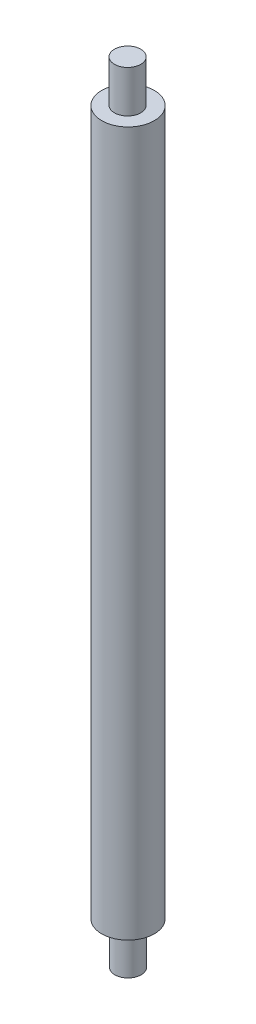
from build123d import *

# Parameters (mm, degrees)
SKETCH1_R           = 6.35
BOSS_EXTRUDE1_DEPTH = 190.5
CUT_EXTRUDE1_START  = -10.16
SKETCH2_R           = 6.35
SKETCH2_R_2         = 3.175
CUT_EXTRUDE1_DEPTH  = 10.16
SKETCH3_R           = 6.35
SKETCH3_R_2         = 3.175
CUT_EXTRUDE2_DEPTH  = 10.16


with BuildPart() as part:
    # Sketch1 → Boss-Extrude1 (new body)
    with BuildSketch(Plane(origin=(0, 0, 0), x_dir=(1, 0, 0), z_dir=(0, 1, 0))):
        with Locations(Location((0, 0, 0), (0, 0, 270))):
            Circle(SKETCH1_R)
    extrude(amount=BOSS_EXTRUDE1_DEPTH)

    # Sketch2 → Cut-Extrude1 (cut)
    with BuildSketch(Plane(origin=(0, 190.5, 0), x_dir=(1, 0, 0), z_dir=(0, 1, 0)).offset(CUT_EXTRUDE1_START)):
        with Locations(Location((0, 0, 0), (0, 0, 270))):
            Circle(SKETCH2_R)
        with Locations(Location((-0.099052315, 0, 0), (0, 0, 270))):
            Circle(SKETCH2_R_2, mode=Mode.SUBTRACT)
    extrude(amount=CUT_EXTRUDE1_DEPTH, mode=Mode.SUBTRACT)

    # Sketch3 → Cut-Extrude2 (cut)
    with BuildSketch(Plane.XZ):
        with Locations(Location((0, 0, 0), (0, 0, 270))):
            Circle(SKETCH3_R)
        with Locations(Location((0, 0, 0), (0, 0, 270))):
            Circle(SKETCH3_R_2, mode=Mode.SUBTRACT)
    extrude(amount=-CUT_EXTRUDE2_DEPTH, mode=Mode.SUBTRACT)


solid = part.part
